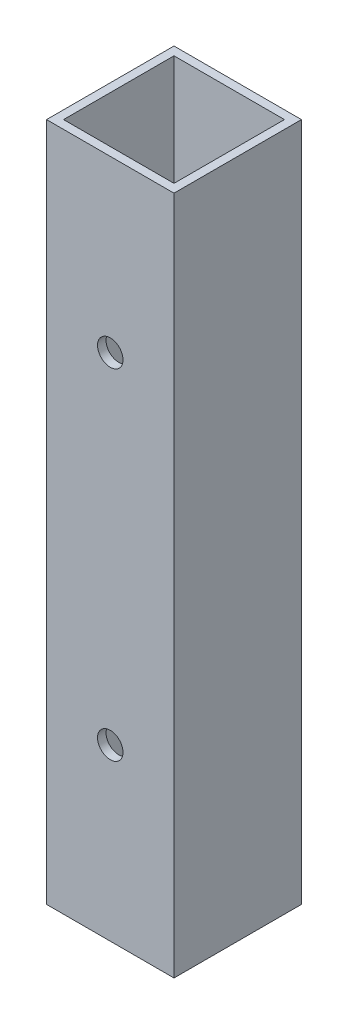
from build123d import *

# Parameters (mm, degrees)
SKETCH_1_W          = 15
SKETCH_1_H          = 15
SKETCH_1_W_2        = 13
SKETCH_1_H_2        = 13
EXTRUDE_1_DEPTH     = 80
SKETCH_2_R          = 1.5
CUT_EXTRUDE_1_DEPTH = 82.738913621


with BuildPart() as part:
    # 草图1 → 凸台-拉伸1 (new body)
    with BuildSketch(Plane(origin=(0, 0, 0), x_dir=(1, 0, 0), z_dir=(0, 1, 0))):
        Rectangle(SKETCH_1_W, SKETCH_1_H)
        Rectangle(SKETCH_1_W_2, SKETCH_1_H_2, mode=Mode.SUBTRACT)
    extrude(amount=EXTRUDE_1_DEPTH)

    # 草图2 → 切除-拉伸1 (cut, through all)
    with BuildSketch(Plane.XY.offset(7.5)):
        with Locations((0, 60)):
            Circle(SKETCH_2_R)
        with Locations((0, 20)):
            Circle(SKETCH_2_R)
    extrude(amount=-CUT_EXTRUDE_1_DEPTH, mode=Mode.SUBTRACT)


solid = part.part
